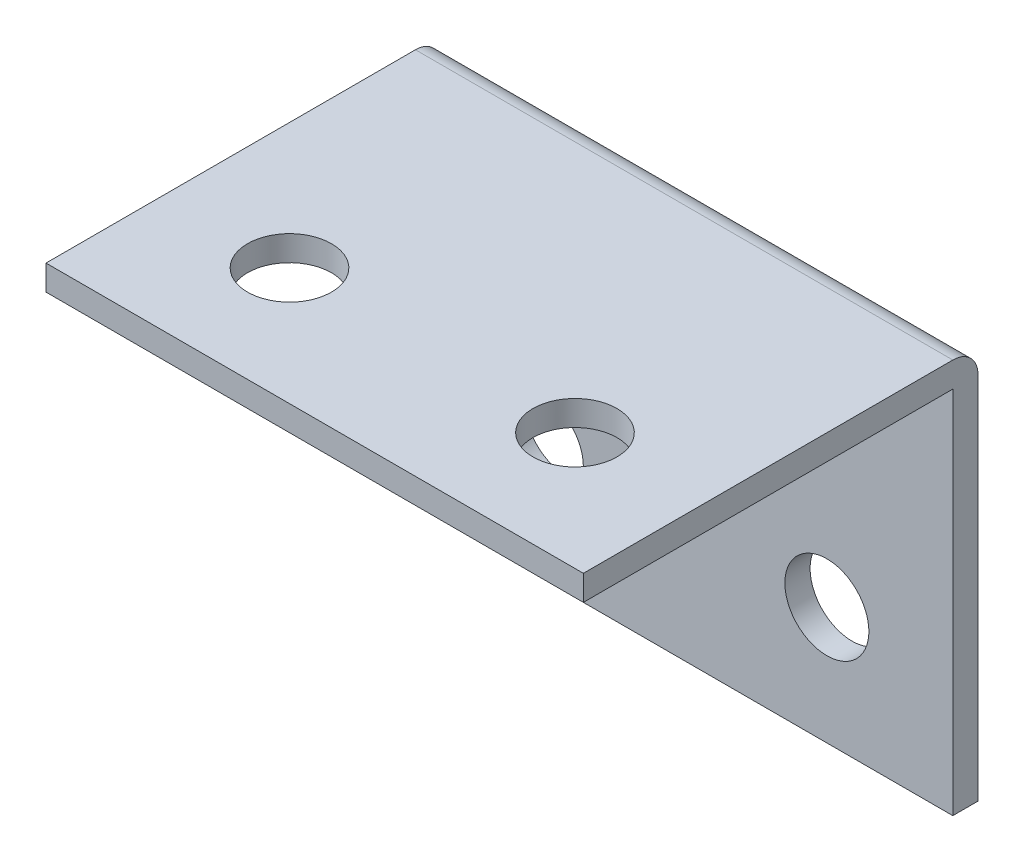
from build123d import *

# Parameters (mm, degrees)
SKETCH_1_W          = 32
SKETCH_1_H          = 23.5
EXTRUDE_2_DEPTH     = 23.5
SHELL_1_T           = -1.5
FILLET_2_R          = 1.5
SKETCH_3_R          = 2.5
CUT_EXTRUDE_2_DEPTH = 23.5
SKETCH_5_R          = 2.5
CUT_EXTRUDE_3_DEPTH = 23.5


with BuildPart() as part:
    # 草图1 → 凸台-拉伸2 (new body)
    with BuildSketch(Plane.XY):
        with Locations((16, 11.75)):
            Rectangle(SKETCH_1_W, SKETCH_1_H)
    extrude(amount=EXTRUDE_2_DEPTH)

    # 抽壳1
    shell_1_openings = [part.faces().sort_by_distance(p)[0] for p in [
        (16, 11.75, 23.5),
        (32, 11.75, 11.75),
        (16, 0, 11.75),
        (0, 11.75, 11.75),
    ]]
    offset(amount=SHELL_1_T, openings=shell_1_openings, kind=Kind.INTERSECTION)

    # 圆角2
    fillet_2_edges = [part.edges().sort_by_distance(p)[0] for p in [
        (16, 23.5, 0),
    ]]
    fillet(fillet_2_edges, radius=FILLET_2_R)

    # 草图3 → 切除-拉伸2 (cut)
    with BuildSketch(Plane.XY.offset(1.5)):
        with Locations((7.5, 7)):
            Circle(SKETCH_3_R)
        with Locations(Location((24.5, 7, 0), (0, 0, 180))):
            Circle(SKETCH_3_R)
    extrude(amount=-CUT_EXTRUDE_2_DEPTH, mode=Mode.SUBTRACT)

    # 草图5 → 切除-拉伸3 (cut)
    with BuildSketch(Plane.XZ.offset(-22)):
        with Locations(Location((7.5, 16.5, 0), (0, 0, 270))):
            Circle(SKETCH_5_R)
        with Locations(Location((24.5, 16.5, 0), (0, 0, 270))):
            Circle(SKETCH_5_R)
    extrude(amount=-CUT_EXTRUDE_3_DEPTH, mode=Mode.SUBTRACT)


solid = part.part
